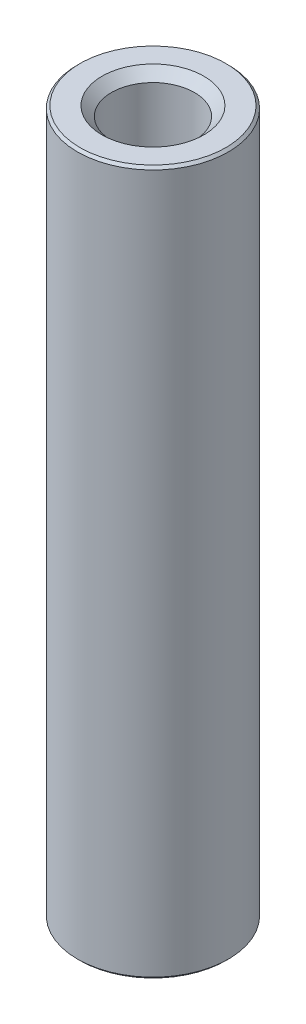
from build123d import *

# Parameters (mm, degrees)
SKETCH_1_R      = 3
EXTRUDE_1_DEPTH = 14
CHAMFER_1_SIZE  = 0.1


with BuildPart() as part:
    # 草图1 → 凸台-拉伸1 (new, symmetric)
    with BuildSketch(Plane(origin=(0, 0, 0), x_dir=(1, 0, 0), z_dir=(0, 1, 0))):
        with Locations(Location((0, 0, 0), (0, 0, 270))):
            Circle(SKETCH_1_R)
    extrude(amount=EXTRUDE_1_DEPTH, both=True)

    # 草图3 → M4 Tapped Hole1 (revolve, cut)
    with BuildSketch(Plane(origin=(0, 14, 0), x_dir=(0, 0, 1), z_dir=(1, 0, 0))):
        Polygon((0, 0), (0, 28), (1.675, 28), (1.65, 27.975), (1.65, 0.375), (2.025, 0), align=None)
    revolve(axis=Axis((0, 20.35, 0), (0, -1, 0)), mode=Mode.SUBTRACT)

    # 倒角1
    chamfer_1_edges = [part.edges().sort_by_distance(p)[0] for p in [
        (0, -14, -3),
        (0, 14, -3),
    ]]
    chamfer(chamfer_1_edges, length=CHAMFER_1_SIZE)


solid = part.part
